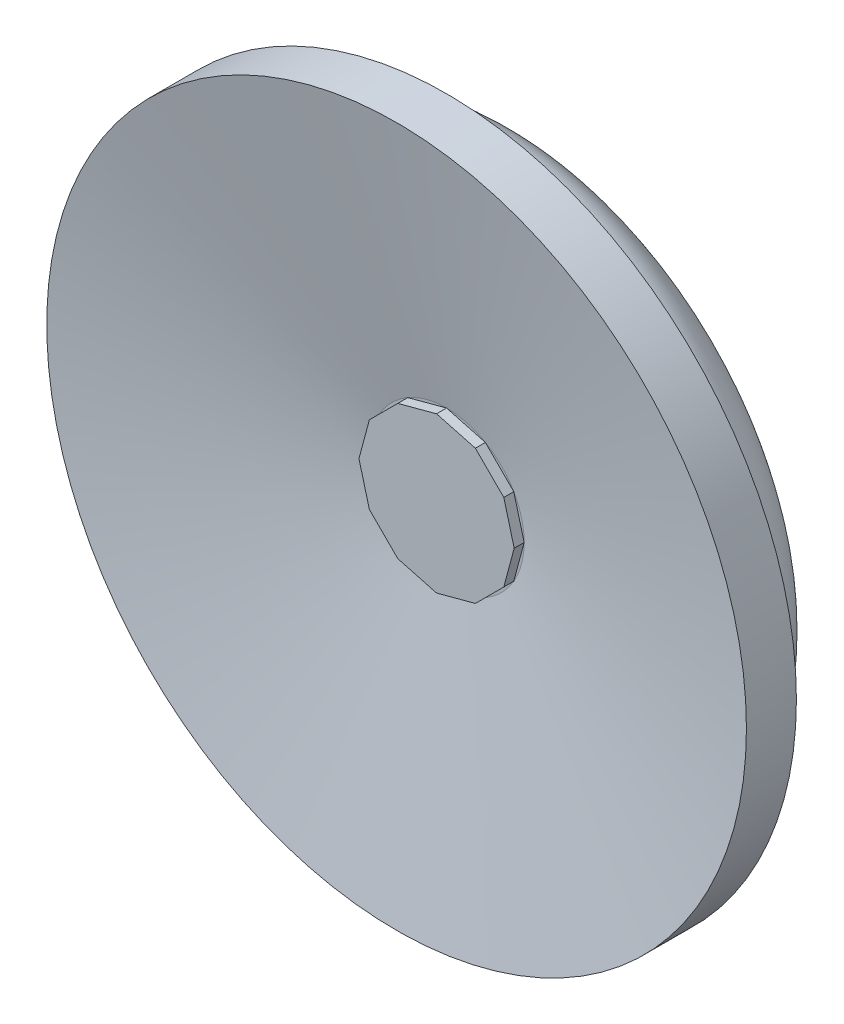
from build123d import *

# Parameters (mm, degrees)
SKETCH2_R           = 70
BOSS_EXTRUDE2_DEPTH = 10
SKETCH3_R           = 61
BOSS_EXTRUDE3_DEPTH = 15
CUT_EXTRUDE2_DEPTH  = 10
SKETCH10_W          = 15.529142706
SKETCH10_H          = 10
BOSS_EXTRUDE4_DEPTH = 2
SKETCH19_R          = 2
BOSS_EXTRUDE5_DEPTH = 16.7
FILLET1_R           = 10


with BuildPart() as part:
    # Sketch2 → Boss-Extrude2 (new body)
    with BuildSketch(Plane.XY):
        Circle(SKETCH2_R)
    extrude(amount=BOSS_EXTRUDE2_DEPTH)

    # Sketch3 → Boss-Extrude3 (add)
    with BuildSketch(Plane.XY):
        Circle(SKETCH3_R)
    extrude(amount=-BOSS_EXTRUDE3_DEPTH)

    # Sketch9 → Cut-Extrude2 (cut)
    with BuildSketch(Plane.XY.offset(10)):
        Polygon((0, 15.529142706), (-7.764571353, 13.448632083), (-13.448632083, 7.764571353), (-15.529142706, 0), (-13.448632083, -7.764571353), (-7.764571353, -13.448632083), (0, -15.529142706), (7.764571353, -13.448632083), (13.448632083, -7.764571353), (15.529142706, 0), (13.448632083, 7.764571353), (7.764571353, 13.448632083), align=None)
    extrude(amount=-CUT_EXTRUDE2_DEPTH, mode=Mode.SUBTRACT)

    # Sketch10 → Cut-Revolve7 (revolve, cut)
    with BuildSketch(Plane(origin=(0, 0, 0), x_dir=(1, 0, 0), z_dir=(0, 1, 0)), mode=Mode.PRIVATE) as cut_revolve7_sk:
        Polygon((-70, -10), (-15.529142706, -10), (-15.529142706, 0), align=None)
        with Locations((-7.764571353, -5)):
            Rectangle(SKETCH10_W, SKETCH10_H)
    revolve(cut_revolve7_sk.sketch.rotate(Axis((0, 0, 10), (0, 0, -1)), 180), axis=Axis((0, 0, 10), (0, 0, -1)), mode=Mode.SUBTRACT)

    # Sketch14 → Boss-Extrude4 (add)
    with BuildSketch(Plane.XY):
        Polygon((0, 15.529142706), (-7.764571353, 13.448632083), (-13.448632083, 7.764571353), (-15.529142706, 0), (-13.448632083, -7.764571353), (-7.764571353, -13.448632083), (0, -15.529142706), (7.764571353, -13.448632083), (13.448632083, -7.764571353), (15.529142706, 0), (13.448632083, 7.764571353), (7.764571353, 13.448632083), align=None)
    extrude(amount=BOSS_EXTRUDE4_DEPTH)

    # Sketch19 → Boss-Extrude5 (add)
    with BuildSketch(Plane(origin=(0, 0, -15), x_dir=(-1, 0, 0), z_dir=(0, 0, -1))):
        with Locations(Location((0, 0, 0), (0, 0, 180))):
            Circle(SKETCH19_R)
    extrude(amount=BOSS_EXTRUDE5_DEPTH)

    # Sketch22 → Revolve2 (revolve)
    with BuildSketch(Plane(origin=(0, 0, -34.3), x_dir=(-1, 0, 0), z_dir=(0, 0, -1))):
        with BuildLine():
            Line((0, -3.7), (0, 3.7))
            ThreePointArc((0, 3.7), (-3.7, 0), (0, -3.7))
        make_face()
    revolve(axis=Axis((0, -3.7, -34.3), (0, 1, 0)))

    # Fillet1
    fillet1_edges = [part.edges().sort_by_distance(p)[0] for p in [
        (-2, 0, -15),
        (-2, 0, -31.187123517),
        (-61, 0, -15),
    ]]
    fillet(fillet1_edges, radius=FILLET1_R)


solid = part.part
